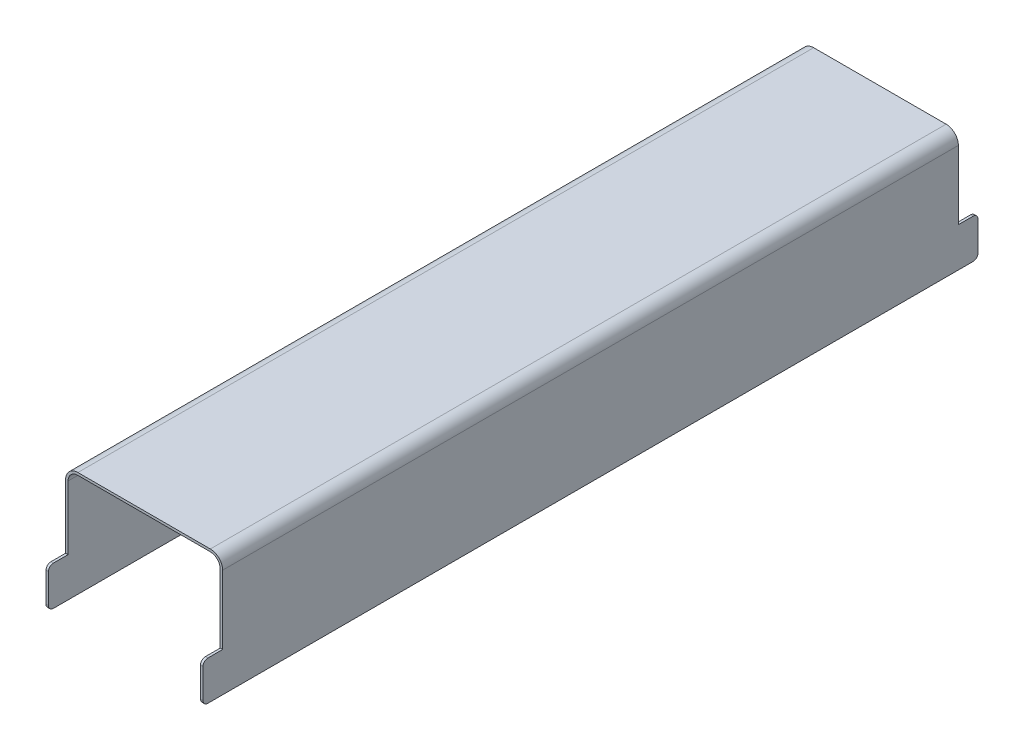
from build123d import *

# Parameters (mm, degrees)
BOSS_EXTRUDE1_DEPTH = 75
BOSS_EXTRUDE2_DEPTH = 0.25
BOSS_EXTRUDE3_DEPTH = 0.25


with BuildPart() as part:
    # Sketch2 → Boss-Extrude1 (new, symmetric)
    with BuildSketch(Plane.XY):
        with BuildLine():
            Line((15.5, -24), (15.5, -2))
            ThreePointArc((15.5, -2), (14.914213562, -0.585786438), (13.5, 0))
            Line((13.5, 0), (-13.5, 0))
            ThreePointArc((-13.5, 0), (-14.914213562, -0.585786438), (-15.5, -2))
            Line((-15.5, -2), (-15.5, -23))
            Line((-15.5, -23), (-16, -23))
            Line((-16, -23), (-16, -2))
            ThreePointArc((-16, -2), (-15.267766953, -0.232233047), (-13.5, 0.5))
            Line((-13.5, 0.5), (13.5, 0.5))
            ThreePointArc((13.5, 0.5), (15.267766953, -0.232233047), (16, -2))
            Line((16, -2), (16, -24))
            Line((16, -24), (15.5, -24))
        make_face()
    extrude(amount=BOSS_EXTRUDE1_DEPTH, both=True)

    # Sketch3 → Boss-Extrude2 (add, symmetric)
    with BuildSketch(Plane(origin=(15.75, 0, 0), x_dir=(0, 0, -1), z_dir=(1, 0, 0))):
        with BuildLine():
            Line((-75, -24), (-78, -24))
            ThreePointArc((-78, -24), (-78.707106781, -23.707106781), (-79, -23))
            Line((-79, -23), (-79, -17))
            ThreePointArc((-79, -17), (-78.707106781, -16.292893219), (-78, -16))
            Line((-78, -16), (-75, -16))
            Line((-75, -16), (-75, -24))
        make_face()
        with BuildLine():
            Line((75, -24), (78, -24))
            ThreePointArc((78, -24), (78.707106781, -23.707106781), (79, -23))
            Line((79, -23), (79, -17))
            ThreePointArc((79, -17), (78.707106781, -16.292893219), (78, -16))
            Line((78, -16), (75, -16))
            Line((75, -16), (75, -24))
        make_face()
    extrude(amount=BOSS_EXTRUDE2_DEPTH, both=True)

    # Sketch4 → Boss-Extrude3 (add, symmetric)
    with BuildSketch(Plane(origin=(-15.75, 0, 0), x_dir=(0, 0, -1), z_dir=(1, 0, 0))):
        with BuildLine():
            Line((-75, -23), (-78, -23))
            ThreePointArc((-78, -23), (-78.707106781, -22.707106781), (-79, -22))
            Line((-79, -22), (-79, -16))
            ThreePointArc((-79, -16), (-78.707106781, -15.292893219), (-78, -15))
            Line((-78, -15), (-75, -15))
            Line((-75, -15), (-75, -23))
        make_face()
        with BuildLine():
            Line((79, -22), (79, -16))
            ThreePointArc((79, -16), (78.707106781, -15.292893219), (78, -15))
            Line((78, -15), (75, -15))
            Line((75, -15), (75, -23))
            Line((75, -23), (78, -23))
            ThreePointArc((78, -23), (78.707106781, -22.707106781), (79, -22))
        make_face()
    extrude(amount=BOSS_EXTRUDE3_DEPTH, both=True)


solid = part.part
